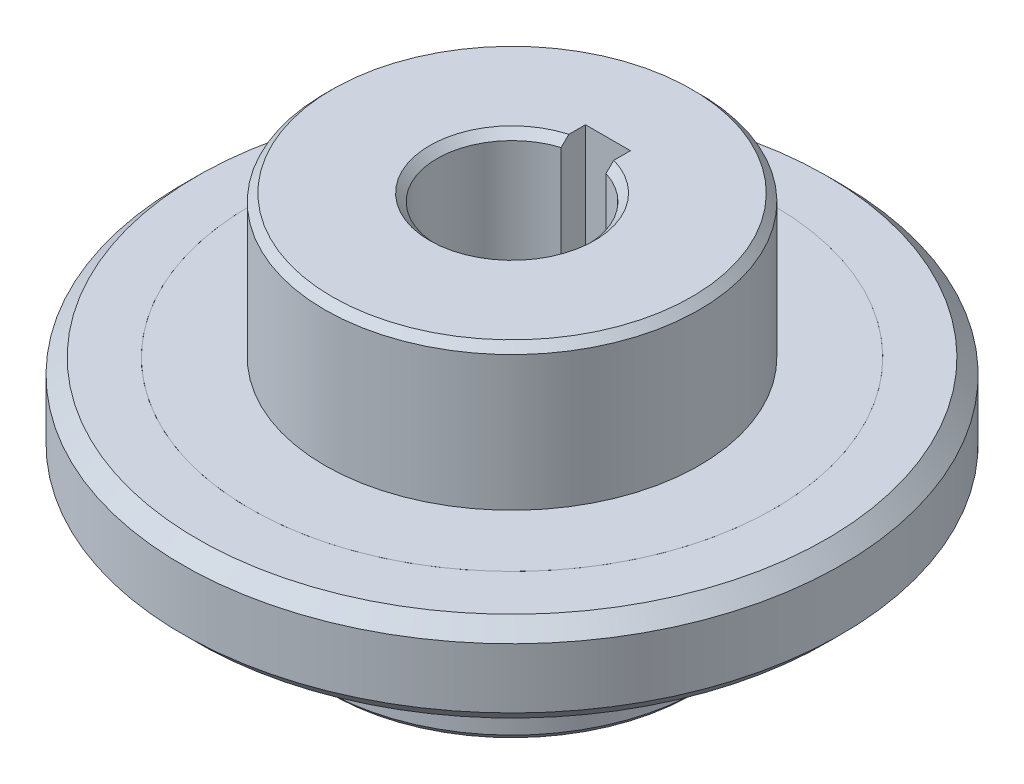
from build123d import *

# Parameters (mm, degrees)
SKETCH_5_W          = 12.5
SKETCH_5_H          = 23
SKETCH_10_R         = 5
CUT_EXTRUDE_3_DEPTH = 39.691197966
CHAMFER_3_SIZE      = 0.5
SKETCH_2_W          = 3
SKETCH_2_H          = 54.842712326
CUT_EXTRUDE_1_DEPTH = 6.4


with BuildPart() as part:
    # Эскиз1 → Revolve 729 (revolve)
    with BuildSketch(Plane.XY):
        Polygon((0, 6), (0, 0), (17.5, 0), (17.5, 6), (11, 6), align=None)
    revolve(axis=Axis((0, 0, 0), (0, 1, 0)))

    # Эскиз3 → Revolve 1176 (revolve)
    with BuildSketch(Plane.XY):
        Polygon((17.4999, -0.0001), (17.4999, 6.0001), (21.000041421, 6.0001), (22.0001, 5.000041421), (22.0001, 0.999958579), (21.000041421, -0.0001), align=None)
        Polygon((17.5, 0), (17.5, 6), (21, 6), (22, 5), (22, 1), (21, 0), align=None, mode=Mode.SUBTRACT)
    revolve(axis=Axis((0, 0, 0), (0, 1, 0)))

    # Эскиз5 → Revolve 2677 (revolve)
    with BuildSketch(Plane.XY):
        with Locations((6.25, 4)):
            Rectangle(SKETCH_5_W, SKETCH_5_H)
    revolve(axis=Axis((0, -50, 0), (0, 1, 0)))

    # Эскиз10 → Вырез-Вытянуть3 (cut, through all)
    with BuildSketch(Plane(origin=(0, 15.5, 0), x_dir=(1, 0, 0), z_dir=(0, 1, 0))):
        Circle(SKETCH_10_R)
    extrude(amount=-CUT_EXTRUDE_3_DEPTH, mode=Mode.SUBTRACT)

    # Фаска3
    chamfer_3_edges = [part.edges().sort_by_distance(p)[0] for p in [
        (-12.5, 15.5, 0),
        (-12.5, -7.5, 0),
        (-5, -7.5, 0),
        (-5, 15.5, 0),
    ]]
    chamfer(chamfer_3_edges, length=CHAMFER_3_SIZE)

    # Эскиз2 → Вырез-Вытянуть1 (cut)
    with BuildSketch(Plane.XY):
        Rectangle(SKETCH_2_W, SKETCH_2_H)
    extrude(amount=-CUT_EXTRUDE_1_DEPTH, mode=Mode.SUBTRACT)


solid = part.part
